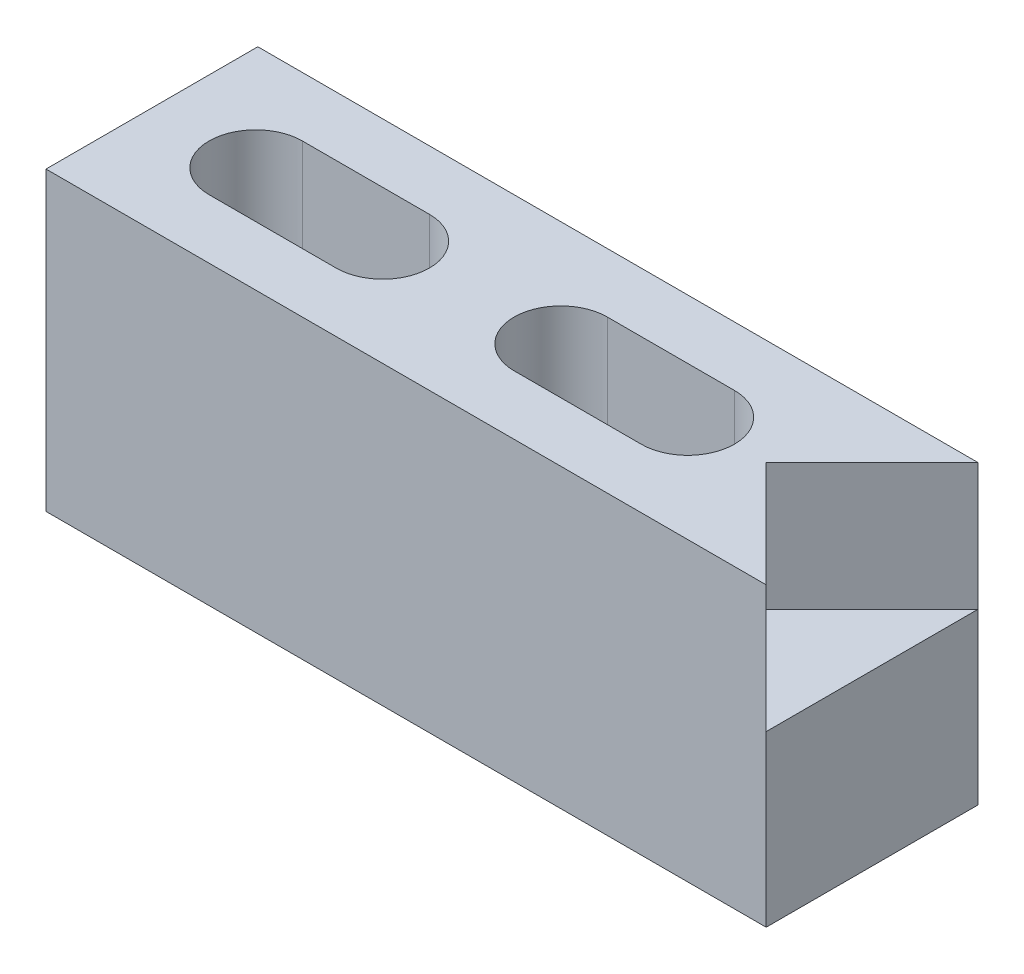
from build123d import *

# Parameters (mm, degrees)
SKETCH1_W           = 43.18
SKETCH1_H           = 17.78
BOSS_EXTRUDE1_DEPTH = 12.7
CUT_EXTRUDE1_DEPTH  = 7.62
CUT_EXTRUDE2_DEPTH  = 49.393499563


with BuildPart() as part:
    # Sketch1 → Boss-Extrude1 (new body)
    with BuildSketch(Plane.XY):
        with Locations((21.59, 8.89)):
            Rectangle(SKETCH1_W, SKETCH1_H)
    extrude(amount=-BOSS_EXTRUDE1_DEPTH)

    # Sketch3 → Cut-Extrude1 (cut)
    with BuildSketch(Plane(origin=(0, 17.78, 0), x_dir=(1, 0, 0), z_dir=(0, 1, 0))):
        Polygon((43.18, 12.7), (36.83, 6.35), (43.18, 0), align=None)
    extrude(amount=-CUT_EXTRUDE1_DEPTH, mode=Mode.SUBTRACT)

    # Sketch4 → Cut-Extrude2 (cut, through all)
    with BuildSketch(Plane(origin=(0, 17.78, 0), x_dir=(1, 0, 0), z_dir=(0, 1, 0))):
        with BuildLine():
            Line((32.131, 3.556), (24.511, 3.556))
            ThreePointArc((24.511, 3.556), (21.717, 6.35), (24.511, 9.144))
            Line((24.511, 9.144), (32.131, 9.144))
            ThreePointArc((32.131, 9.144), (34.925, 6.35), (32.131, 3.556))
        make_face()
        with BuildLine():
            Line((13.843, 3.556), (6.223, 3.556))
            ThreePointArc((6.223, 3.556), (3.429, 6.35), (6.223, 9.144))
            Line((6.223, 9.144), (13.843, 9.144))
            ThreePointArc((13.843, 9.144), (16.637, 6.35), (13.843, 3.556))
        make_face()
    extrude(amount=-CUT_EXTRUDE2_DEPTH, mode=Mode.SUBTRACT)


solid = part.part
